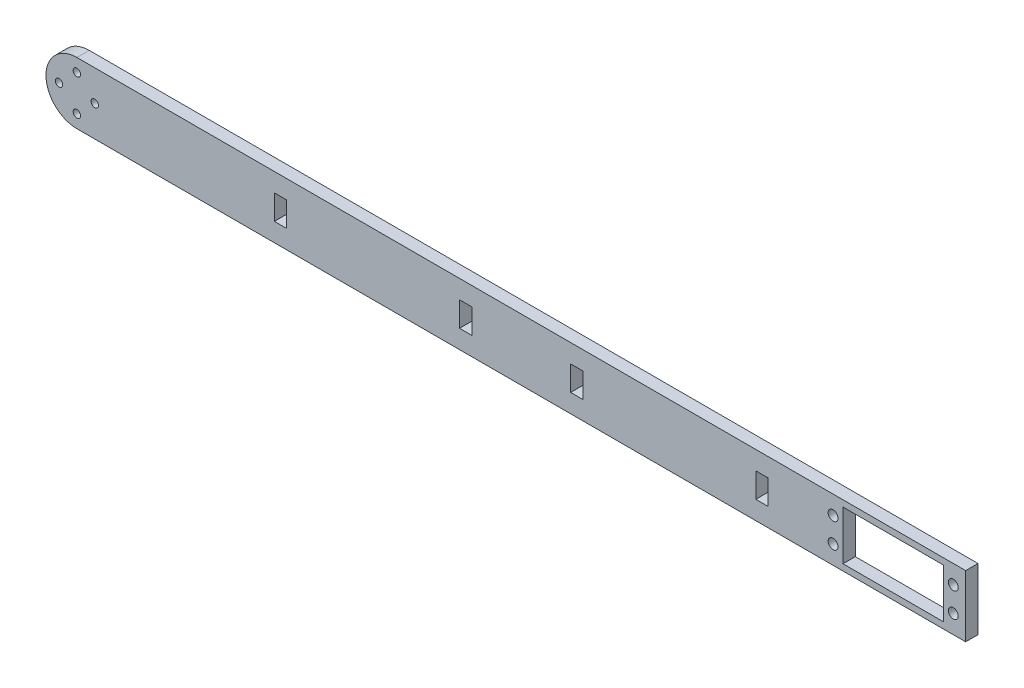
from build123d import *

# Parameters (mm, degrees)
SKETCH_1_R          = 1.5
EXTRUDE_1_DEPTH     = 5
SKETCH_4_W          = 40.7
SKETCH_4_H          = 19.9
CUT_EXTRUDE_1_DEPTH = 361.251648157
SKETCH_6_W          = 5
SKETCH_6_H          = 10
CUT_EXTRUDE_2_DEPTH = 361.251648157
SKETCH_7_R          = 2
CUT_EXTRUDE_3_DEPTH = 361.251648157


with BuildPart() as part:
    # 스케치1 → 보스-돌출1 (new body)
    with BuildSketch(Plane.XY):
        with BuildLine():
            Line((0, -12.5), (360, -12.5))
            Line((360, -12.5), (360, 12.5))
            Line((360, 12.5), (0, 12.5))
            ThreePointArc((0, 12.5), (-12.5, 0), (0, -12.5))
        make_face()
        with Locations((0, 7.25)):
            Circle(SKETCH_1_R, mode=Mode.SUBTRACT)
        with Locations((7.25, 0)):
            Circle(SKETCH_1_R, mode=Mode.SUBTRACT)
        with Locations((0, -7.25)):
            Circle(SKETCH_1_R, mode=Mode.SUBTRACT)
        with Locations((-7.25, 0)):
            Circle(SKETCH_1_R, mode=Mode.SUBTRACT)
    extrude(amount=EXTRUDE_1_DEPTH)

    # 스케치4 → 컷-돌출1 (cut, through all)
    with BuildSketch(Plane.XY.offset(5)):
        with Locations((330.65, 0)):
            Rectangle(SKETCH_4_W, SKETCH_4_H)
    extrude(amount=-CUT_EXTRUDE_1_DEPTH, mode=Mode.SUBTRACT)

    # 스케치6 → 컷-돌출2 (cut, through all)
    with BuildSketch(Plane.XY.offset(5)):
        with Locations((82.5, 0)):
            Rectangle(SKETCH_6_W, SKETCH_6_H)
        with Locations((202.5, 0)):
            Rectangle(SKETCH_6_W, SKETCH_6_H)
        with Locations((157.5, 0)):
            Rectangle(SKETCH_6_W, SKETCH_6_H)
        with Locations((277.5, 0)):
            Rectangle(SKETCH_6_W, SKETCH_6_H)
    extrude(amount=-CUT_EXTRUDE_2_DEPTH, mode=Mode.SUBTRACT)

    # 스케치7 → 컷-돌출3 (cut, through all)
    with BuildSketch(Plane.XY.offset(5)):
        with Locations((355, 5)):
            Circle(SKETCH_7_R)
        with Locations(Location((355, -5, 0), (0, 0, 180))):
            Circle(SKETCH_7_R)
        with Locations(Location((306.3, 5, 0), (0, 0, 180))):
            Circle(SKETCH_7_R)
        with Locations((306.3, -5)):
            Circle(SKETCH_7_R)
    extrude(amount=-CUT_EXTRUDE_3_DEPTH, mode=Mode.SUBTRACT)


solid = part.part
